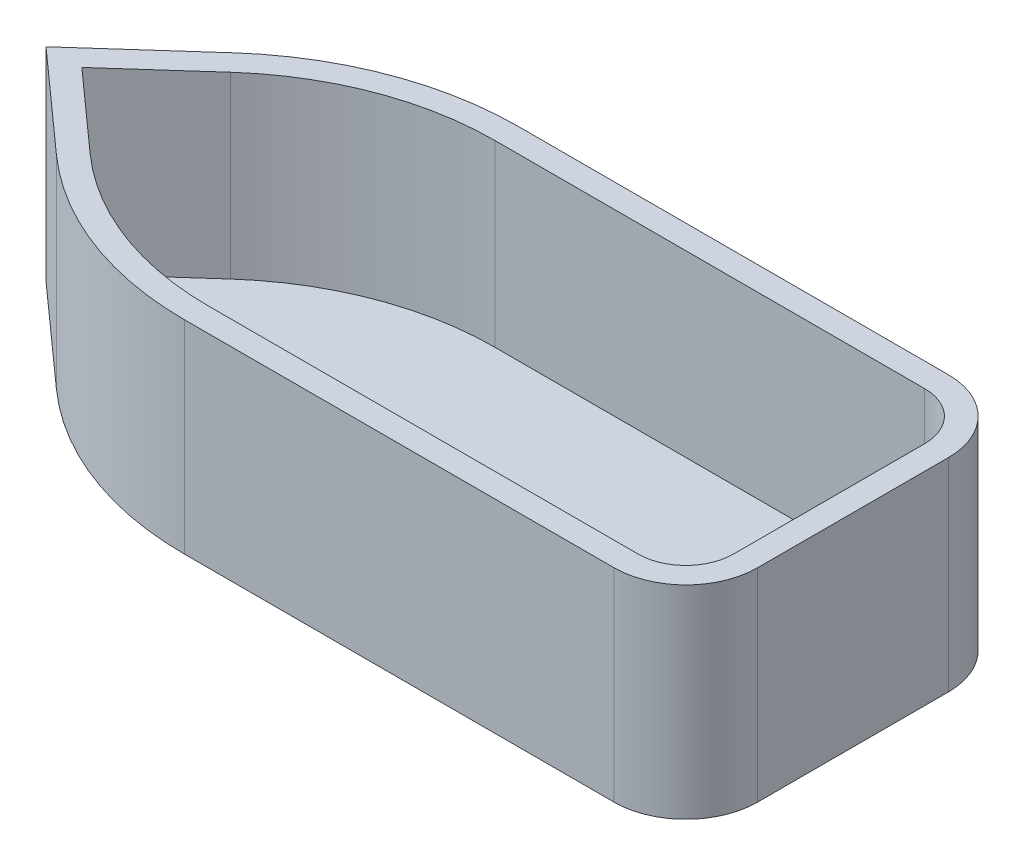
from build123d import *

# Parameters (mm, degrees)
BOSS_EXTRUDE1_DEPTH = 75
SHELL1_T            = 10


with BuildPart() as part:
    # Sketch1 → Boss-Extrude1 (new body)
    with BuildSketch(Plane(origin=(0, 0, 0), x_dir=(1, 0, 0), z_dir=(0, 1, 0))):
        with BuildLine():
            Line((-317.803806735, 29.4427191), (-350.72176741, 0))
            Line((-350.72176741, 0), (-317.803806735, -29.4427191))
            ThreePointArc((-317.803806735, -29.4427191), (-280.622457508, -52.100683076), (-237.803806735, -60))
            Line((-237.803806735, -60), (-57.803806735, -60))
            ThreePointArc((-57.803806735, -60), (-43.661671111, -54.142135624), (-37.803806735, -40))
            Line((-37.803806735, -40), (-37.803806735, 40))
            ThreePointArc((-37.803806735, 40), (-43.661671111, 54.142135624), (-57.803806735, 60))
            Line((-57.803806735, 60), (-237.803806735, 60))
            ThreePointArc((-237.803806735, 60), (-280.622457508, 52.100683076), (-317.803806735, 29.4427191))
        make_face()
    extrude(amount=BOSS_EXTRUDE1_DEPTH)

    # Shell1
    shell1_openings = [part.faces().sort_by_distance(p)[0] for p in [
        (-177.328233539, 75, 0),
    ]]
    offset(amount=SHELL1_T, openings=shell1_openings, kind=Kind.INTERSECTION)


solid = part.part
